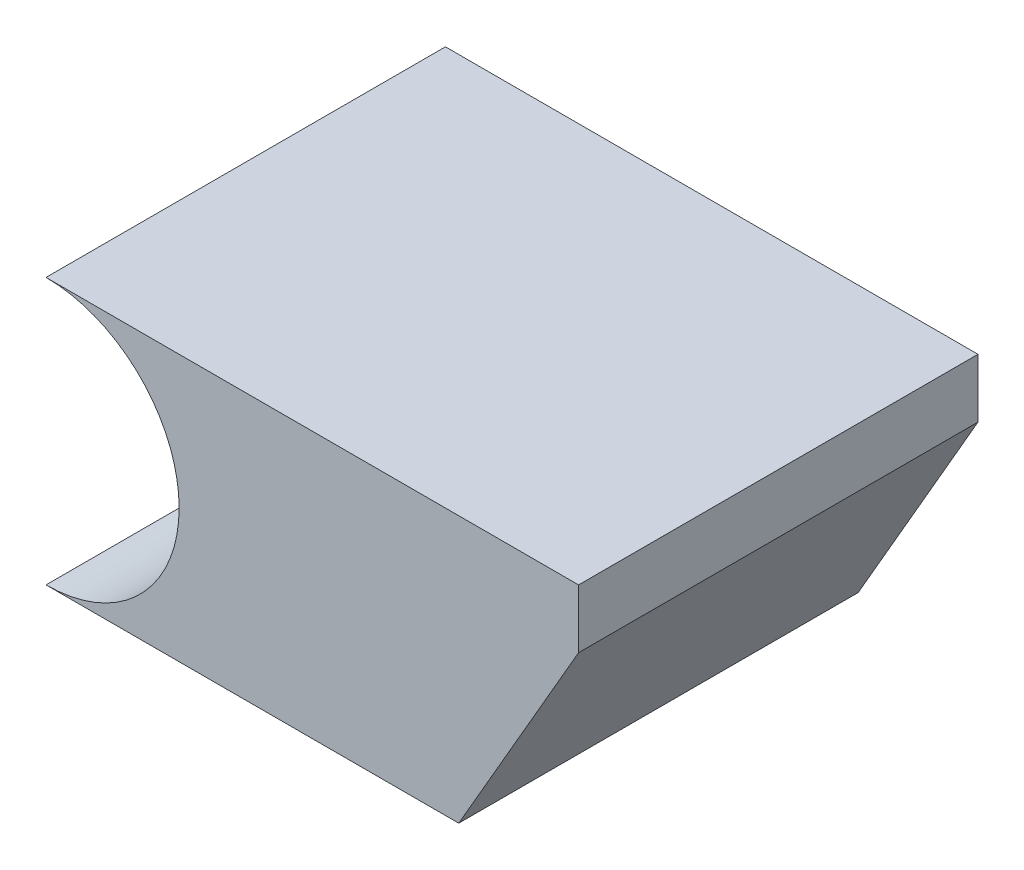
from build123d import *

# Parameters (mm, degrees)
BOSS_EXTRUDE1_DEPTH = 38.1
CHAMFER1_SIZE       = 11.43
CHAMFER1_SIZE2      = 19.797340731


with BuildPart() as part:
    # Sketch1 → Boss-Extrude1 (new body)
    with BuildSketch(Plane.XY):
        with BuildLine():
            Line((0, 0), (50.8, 0))
            Line((50.8, 0), (50.8, 25.4))
            Line((50.8, 25.4), (0, 25.4))
            ThreePointArc((0, 25.4), (12.7, 12.7), (0, 0))
        make_face()
    extrude(amount=BOSS_EXTRUDE1_DEPTH)

    # Chamfer1
    chamfer1_edges = [part.edges().sort_by_distance(p)[0] for p in [
        (50.8, 0, 19.05),
    ]]
    chamfer1_side = [part.faces().sort_by_distance(p)[0] for p in [
        (25.4, 0, 19.05),
    ]]
    chamfer(chamfer1_edges, length=CHAMFER1_SIZE, length2=CHAMFER1_SIZE2, reference=chamfer1_side[0])


solid = part.part
